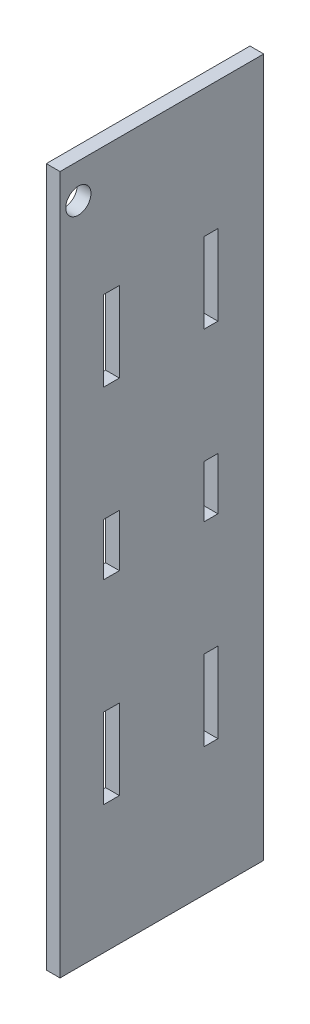
from build123d import *

# Parameters (mm, degrees)
SKETCH1_W           = 304.8
SKETCH1_H           = 88.9
SKETCH1_R           = 5.5
SKETCH1_W_2         = 35
SKETCH1_H_2         = 6
SKETCH1_W_3         = 22.8
SKETCH1_H_3         = 7
BOSS_EXTRUDE1_DEPTH = 6


with BuildPart() as part:
    # Sketch1 → Boss-Extrude1 (new body)
    with BuildSketch(Plane.YZ):
        with Locations((102.640236686, 12.152975526)):
            Rectangle(SKETCH1_W, SKETCH1_H)
        with Locations(Location((240.040236686, 48.602975526, 0), (0, 0, 270))):
            Circle(SKETCH1_R, mode=Mode.SUBTRACT)
        with Locations((23.740236686, -9.297024474)):
            Rectangle(SKETCH1_W_2, SKETCH1_H_2, mode=Mode.SUBTRACT)
        with Locations((102.640236686, -9.297024474)):
            Rectangle(SKETCH1_W_3, SKETCH1_H_2, mode=Mode.SUBTRACT)
        with Locations((181.540236686, -9.297024474)):
            Rectangle(SKETCH1_W_2, SKETCH1_H_2, mode=Mode.SUBTRACT)
        with Locations((23.740236686, 34.202975526)):
            Rectangle(SKETCH1_W_2, SKETCH1_H_3, mode=Mode.SUBTRACT)
        with Locations((102.640236686, 34.202975526)):
            Rectangle(SKETCH1_W_3, SKETCH1_H_3, mode=Mode.SUBTRACT)
        with Locations((181.540236686, 34.202975526)):
            Rectangle(SKETCH1_W_2, SKETCH1_H_3, mode=Mode.SUBTRACT)
    extrude(amount=BOSS_EXTRUDE1_DEPTH)


solid = part.part
